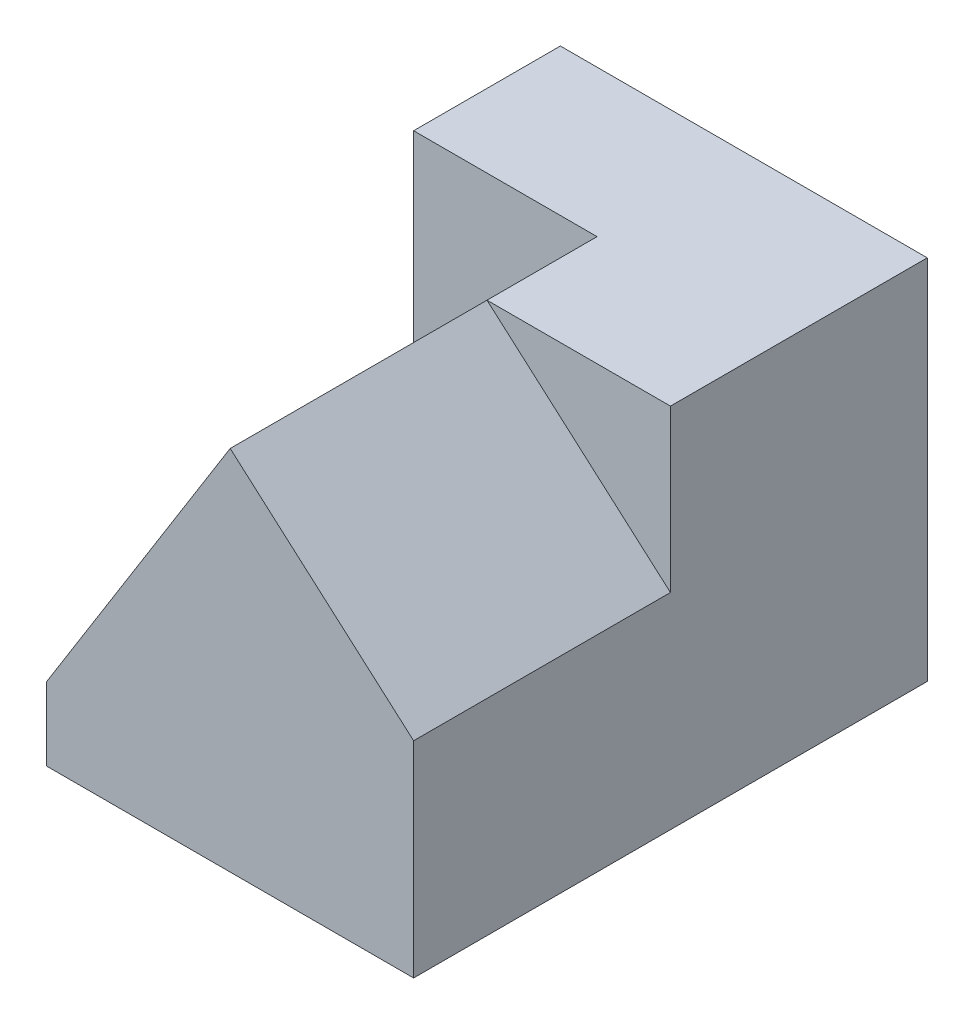
from build123d import *

# Parameters (mm, degrees)
BOSS_EXTRUDE1_DEPTH = 70
BOSS_EXTRUDE2_REACH = 91.582


with BuildPart() as part:
    # Sketch1 → Boss-Extrude1 (new body)
    with BuildSketch(Plane.XY):
        Polygon((-25, 0), (25, 0), (25, 28), (0, 50), (-25, 10), align=None)
    extrude(amount=BOSS_EXTRUDE1_DEPTH)

    # Boss-Extrude2: up to this face of the body (flat: up to its plane)
    boss_extrude2_end = Plane(part.part.faces().sort_by_distance((0, 0, 35))[0])
    # Sketch2 → Boss-Extrude2 (add, up to the picked face)
    with BuildSketch(Plane(origin=(0, 50, 0), x_dir=(1, 0, 0), z_dir=(0, 1, 0)), mode=Mode.PRIVATE) as boss_extrude2_sk1:
        Polygon((25, -35), (25, 0), (-25, 0), (-25, -20), (0, -20), (0, -35), align=None)
    boss_extrude2_tool1 = split(extrude(boss_extrude2_sk1.sketch, amount=-BOSS_EXTRUDE2_REACH, mode=Mode.PRIVATE), bisect_by=boss_extrude2_end, keep=Keep.BOTH, mode=Mode.PRIVATE)
    add(boss_extrude2_tool1.solids().sort_by(Axis((3.409091, 50, 14.772727), (0, -1, 0)))[0])


solid = part.part
